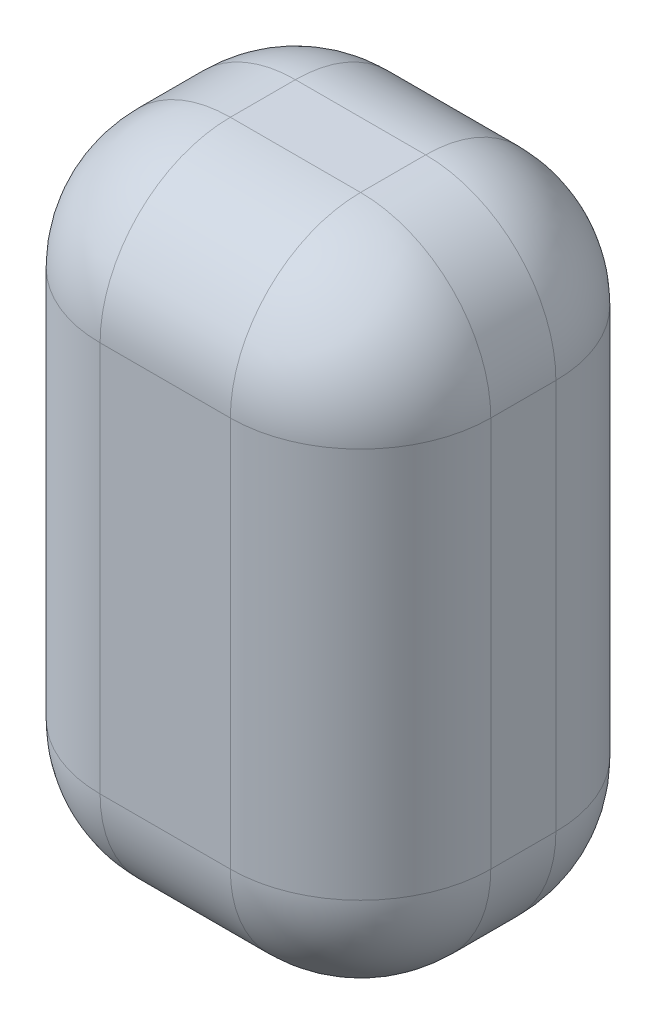
from build123d import *

# Parameters (mm, degrees)
SKETCH9_W           = 60
SKETCH9_H           = 50
BOSS_EXTRUDE2_DEPTH = 100
FILLET3_R           = 20


with BuildPart() as part:
    # Sketch9 → Boss-Extrude2 (new body)
    with BuildSketch(Plane(origin=(0, 0, 0), x_dir=(1, 0, 0), z_dir=(0, 1, 0))):
        Rectangle(SKETCH9_W, SKETCH9_H)
    extrude(amount=BOSS_EXTRUDE2_DEPTH)

    # Fillet3
    fillet3_edges = [part.edges().sort_by_distance(p)[0] for p in [
        (-30, 100, 0),
        (0, 100, 25),
        (30, 100, 0),
        (0, 0, 25),
        (-30, 0, 0),
        (0, 0, -25),
        (30, 0, 0),
        (0, 100, -25),
        (30, 50, 25),
        (-30, 50, 25),
        (-30, 50, -25),
        (30, 50, -25),
    ]]
    fillet(fillet3_edges, radius=FILLET3_R)


solid = part.part
